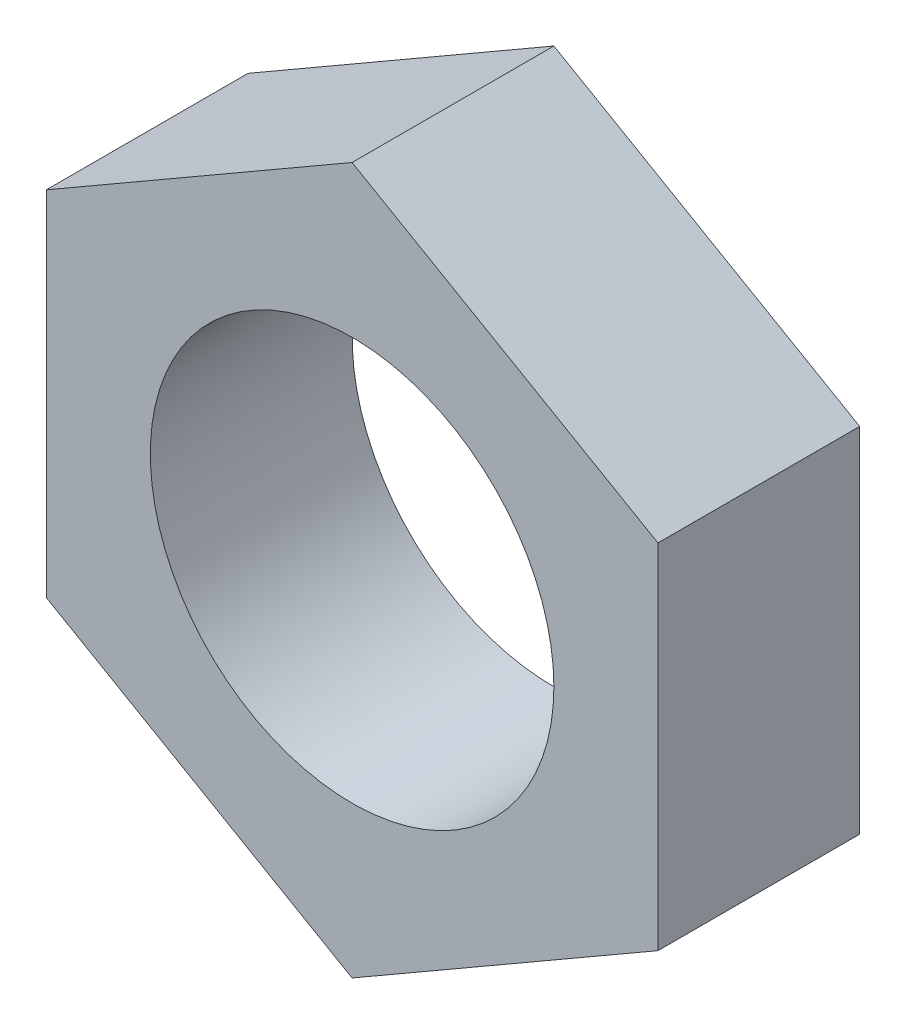
from build123d import *

# Parameters (mm, degrees)
SCHIZZO1_R                   = 2
ESTRUSIONE_ESTRUSIONE1_DEPTH = 2


with BuildPart() as part:
    # Schizzo1 → Estrusione-Estrusione1 (new body)
    with BuildSketch(Plane.XY):
        Polygon((-3.031088913, 1.75), (-3.031088913, -1.75), (0, -3.5), (3.031088913, -1.75), (3.031088913, 1.75), (0, 3.5), align=None)
        Circle(SCHIZZO1_R, mode=Mode.SUBTRACT)
    extrude(amount=ESTRUSIONE_ESTRUSIONE1_DEPTH)


solid = part.part
